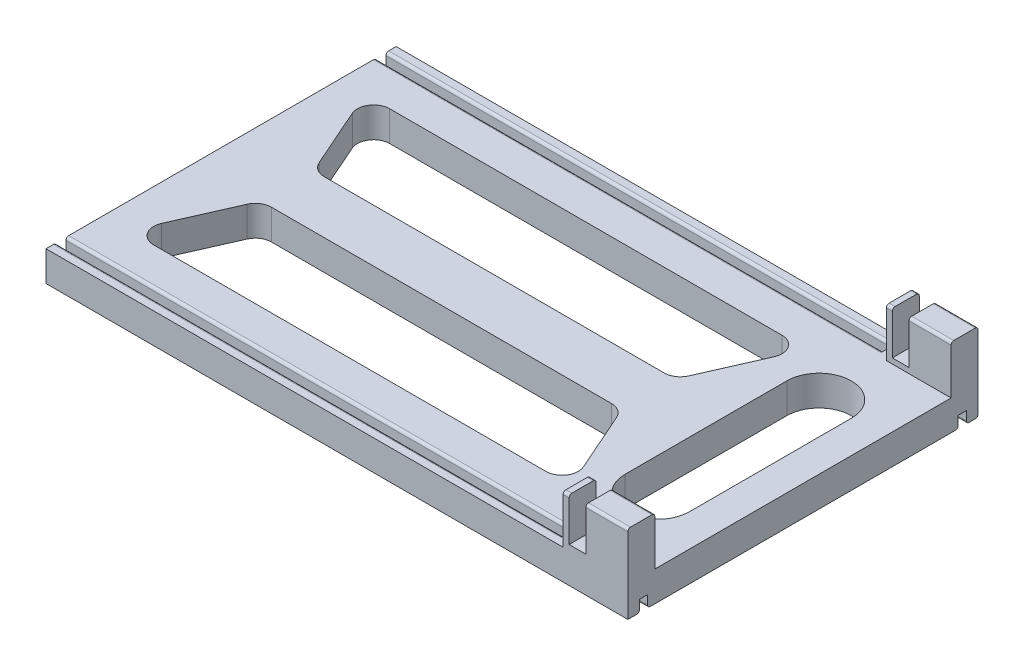
from build123d import *

# Parameters (mm, degrees)
BOSS_EXTRUDE1_DEPTH = 108
BOSS_EXTRUDE3_REACH = 114.923
SKETCH5_W           = 13.804456559
SKETCH5_H           = 5
SKETCH7_W           = 12
SKETCH7_H           = 5
BOSS_EXTRUDE4_DEPTH = 9
SKETCH8_W           = 3.1
SKETCH8_H           = 5
CUT_EXTRUDE1_DEPTH  = 8
FILLET1_R           = 0.5
FILLET2_R           = 0.5
FILLET3_R           = 0.5
FILLET4_R           = 0.5
FILLET5_R           = 0.5
FILLET6_R           = 0.5
FILLET7_R           = 0.5
FILLET8_R           = 0.5
CUT_EXTRUDE2_DEPTH  = 10
FILLET9_R           = 3


with BuildPart() as part:
    # Sketch1 → Boss-Extrude1 (new body)
    with BuildSketch(Plane(origin=(0, 0, 0), x_dir=(0, 0, -1), z_dir=(1, 0, 0))):
        Polygon((32.5, -0.986763128), (32.5, -6.586763128), (30.340675248, -6.586763128), (30.340675248, -4.436763128), (28.831367778, -4.436763128), (28.831367778, -6.586763128), (-28.831367778, -6.586763128), (-28.831367778, -4.436763128), (-30.340675248, -4.436763128), (-30.340675248, -6.586763128), (-32.5, -6.586763128), (-32.5, -0.986763128), (-30.6, -0.986763128), (-30.6, -3.136763128), (-28.79, -3.136763128), (-28.79, -0.986763128), (28.79, -0.986763128), (28.79, -3.136763128), (30.6, -3.136763128), (30.6, -0.986763128), align=None)
    extrude(amount=BOSS_EXTRUDE1_DEPTH)

    # Sketch5 → Boss-Extrude3 (add, up to next)
    with BuildSketch(Plane(origin=(0, -0.986763128, 0), x_dir=(1, 0, 0), z_dir=(0, 1, 0)), mode=Mode.PRIVATE) as boss_extrude3_sk1:
        with Locations((101.097771721, -30)):
            Rectangle(SKETCH5_W, SKETCH5_H)
    boss_extrude3_tool1 = extrude(boss_extrude3_sk1.sketch, amount=-BOSS_EXTRUDE3_REACH, mode=Mode.PRIVATE) - part.part
    boss_extrude3 = boss_extrude3_tool1.solids().sort_by_distance((101.097772, -0.986763, 30))[0]
    add(boss_extrude3)

    # Sketch7 → Boss-Extrude4 (add)
    with BuildSketch(Plane(origin=(0, -0.986763128, 0), x_dir=(1, 0, 0), z_dir=(0, 1, 0))):
        with Locations((102, -30)):
            Rectangle(SKETCH7_W, SKETCH7_H)
    boss_extrude4 = extrude(amount=BOSS_EXTRUDE4_DEPTH)

    # Mirror1: Boss-Extrude4 across plane
    add(boss_extrude4.mirror(Plane.XY))

    # Mirror2: Boss-Extrude3 across plane
    add(boss_extrude3.mirror(Plane.XY))

    # Sketch8 → Cut-Extrude1 (cut)
    with BuildSketch(Plane(origin=(0, 8.013236872, 0), x_dir=(1, 0, 0), z_dir=(0, 1, 0))):
        with Locations((98.65, -30)):
            Rectangle(SKETCH8_W, SKETCH8_H)
    cut_extrude1 = extrude(amount=-CUT_EXTRUDE1_DEPTH, mode=Mode.SUBTRACT)

    # Mirror3: Cut-Extrude1 across plane
    add(cut_extrude1.mirror(Plane.XY), mode=Mode.SUBTRACT)

    # Fillet1
    fillet1_edges = [part.edges().sort_by_distance(p)[0] for p in [
        (47.09777172, -0.986763128, 30.6),
    ]]
    fillet(fillet1_edges, radius=FILLET1_R)

    # Fillet2
    fillet2_edges = [part.edges().sort_by_distance(p)[0] for p in [
        (47.09777172, -0.986763128, 28.79),
    ]]
    fillet(fillet2_edges, radius=FILLET2_R)

    # Fillet3
    fillet3_edges = [part.edges().sort_by_distance(p)[0] for p in [
        (54, -6.586763128, 30.340675248),
    ]]
    fillet(fillet3_edges, radius=FILLET3_R)

    # Fillet4
    fillet4_edges = [part.edges().sort_by_distance(p)[0] for p in [
        (54, -6.586763128, 28.831367778),
    ]]
    fillet(fillet4_edges, radius=FILLET4_R)

    # Fillet5
    fillet5_edges = [part.edges().sort_by_distance(p)[0] for p in [
        (104.1, 8.013236872, 32.5),
    ]]
    fillet(fillet5_edges, radius=FILLET5_R)

    # Fillet6
    fillet6_edges = [part.edges().sort_by_distance(p)[0] for p in [
        (96.55, 8.013236872, 32.5),
    ]]
    fillet(fillet6_edges, radius=FILLET6_R)

    # Fillet7
    fillet7_edges = [part.edges().sort_by_distance(p)[0] for p in [
        (47.09777172, -0.986763128, -28.79),
        (96.55, 8.013236872, 27.5),
        (104.1, 8.013236872, -32.5),
        (96.55, 8.013236872, -27.5),
        (54, -6.586763128, -32.5),
        (54, -6.586763128, -30.340675248),
        (54, -6.586763128, -28.831367778),
        (104.1, 8.013236872, 27.5),
        (96.55, 8.013236872, -32.5),
        (104.1, 8.013236872, -27.5),
    ]]
    fillet(fillet7_edges, radius=FILLET7_R)

    # Fillet8
    fillet8_edges = [part.edges().sort_by_distance(p)[0] for p in [
        (47.09777172, -0.986763128, -30.6),
    ]]
    fillet(fillet8_edges, radius=FILLET8_R)

    # Sketch9 → Cut-Extrude2 (cut)
    with BuildSketch(Plane(origin=(0, -0.986763128, 0), x_dir=(1, 0, 0), z_dir=(0, 1, 0))):
        with BuildLine():
            Line((90, -15), (90, 15))
            ThreePointArc((90, 15), (96, 21), (102, 15))
            Line((102, 15), (102, -15))
            ThreePointArc((102, -15), (96, -21), (90, -15))
        make_face()
        Polygon((86.8, 21.9), (79.3, 4.9), (12.3, 4.9), (4.8, 21.9), align=None)
        Polygon((4.8, -21.9), (86.8, -21.9), (79.3, -4.9), (12.3, -4.9), align=None)
    extrude(amount=-CUT_EXTRUDE2_DEPTH, mode=Mode.SUBTRACT)

    # Fillet9
    fillet9_edges = [part.edges().sort_by_distance(p)[0] for p in [
        (86.8, -3.786763128, 21.9),
        (4.8, -3.786763128, 21.9),
        (12.3, -3.786763128, 4.9),
        (79.3, -3.786763128, 4.9),
        (4.8, -3.786763128, -21.9),
        (86.8, -3.786763128, -21.9),
        (79.3, -3.786763128, -4.9),
        (12.3, -3.786763128, -4.9),
    ]]
    fillet(fillet9_edges, radius=FILLET9_R)


solid = part.part
